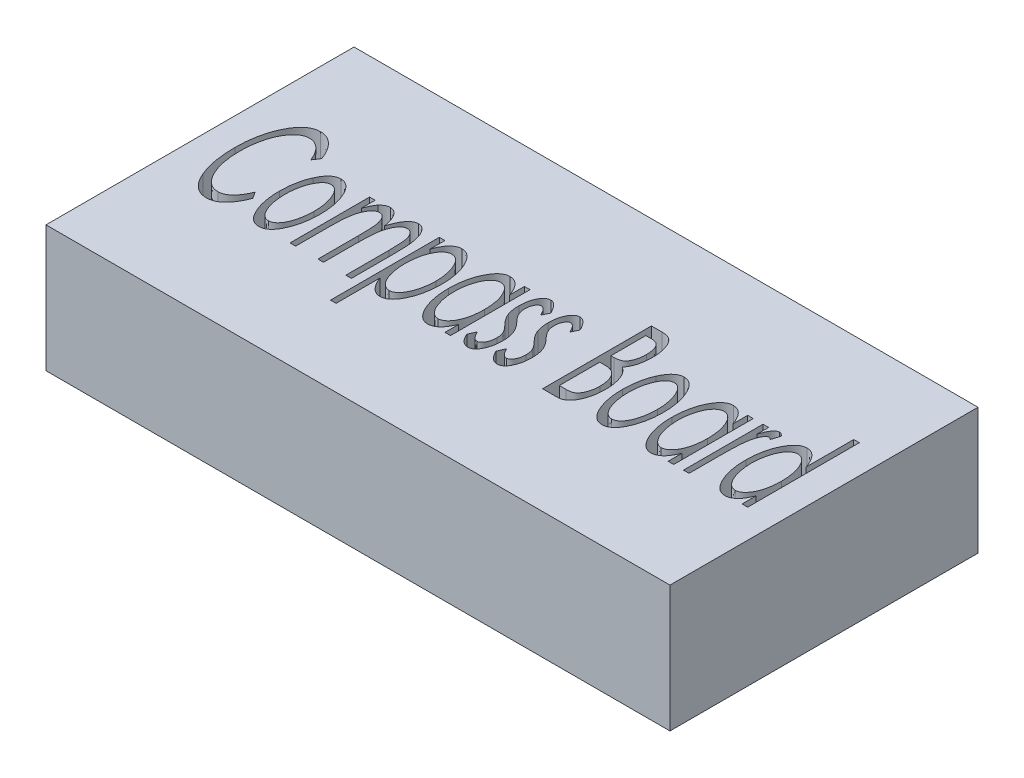
from build123d import *

# Parameters (mm, degrees)
SKETCH1_W           = 20.066
SKETCH1_H           = 9.906
BOSS_EXTRUDE1_DEPTH = 4.064
CUT_EXTRUDE1_DEPTH  = 2.032


with BuildPart() as part:
    # Sketch1 → Boss-Extrude1 (new body)
    with BuildSketch(Plane(origin=(0, 0, 0), x_dir=(1, 0, 0), z_dir=(0, 1, 0))):
        Rectangle(SKETCH1_W, SKETCH1_H)
    extrude(amount=BOSS_EXTRUDE1_DEPTH)

    # Sketch2 → Cut-Extrude1 (cut)
    # profile 1 of 12: a face of its own
    with BuildSketch(Plane(origin=(0, 4.064, 0), x_dir=(1, 0, 0), z_dir=(0, 1, 0))):
        with BuildLine():
            Line((-7.444815121, 1.324255435), (-7.582234993, 1.113918897))
            add(Edge.make_bspline(
                [(-7.582234993, 1.113918897), (-7.601593698, 1.159131827), (-7.638621926, 1.245612543), (-7.70339106, 1.364296518), (-7.775353254, 1.464971916), (-7.852491995, 1.548634953), (-7.934614473, 1.614995075), (-8.021712844, 1.66228317), (-8.113143138, 1.692277373), (-8.176097164, 1.695591787), (-8.207635634, 1.69725223)],
                knots=[0, 0, 0, 0, 1.299185471, 2.485007972, 3.564697683, 4.560911303, 5.483881321, 6.340461428, 7.168610648, 8, 8, 8, 8], degree=3))
            add(Edge.make_bspline(
                [(-8.207635634, 1.69725223), (-8.224982808, 1.696835392), (-8.259729195, 1.696000466), (-8.31092041, 1.685390949), (-8.361342017, 1.670065851), (-8.410689961, 1.648009605), (-8.458923503, 1.619812954), (-8.506577822, 1.585819423), (-8.552418696, 1.545005834), (-8.61342526, 1.481997626), (-8.684284571, 1.39034243), (-8.757665972, 1.264018838), (-8.82248454, 1.121613861), (-8.875414738, 0.962819008), (-8.917859239, 0.790698495), (-8.94849288, 0.607434675), (-8.966890989, 0.413641561), (-8.969247118, 0.281027336), (-8.970456146, 0.212977391)],
                knots=[0, 0, 0, 0, 0.45774643, 0.916866041, 1.375985651, 1.848859789, 2.34149154, 2.850576784, 3.393287444, 3.961145049, 5.167050785, 6.443546623, 7.814561503, 9.295151989, 10.860649304, 12.495527756, 14.201707638, 16, 16, 16, 16], degree=3))
            add(Edge.make_bspline(
                [(-8.970456146, 0.212977391), (-8.96983556, 0.161307023), (-8.968621124, 0.060192466), (-8.957580225, -0.088114462), (-8.941303354, -0.229783803), (-8.917297879, -0.365081808), (-8.886764262, -0.493957053), (-8.848851821, -0.61648957), (-8.803948403, -0.732145379), (-8.753409745, -0.84046125), (-8.697039706, -0.938669549), (-8.637341474, -1.025513048), (-8.57293213, -1.098578227), (-8.505539317, -1.158990736), (-8.433924736, -1.206454536), (-8.358119128, -1.239207257), (-8.278980141, -1.261222385), (-8.224610514, -1.263257292), (-8.197118807, -1.264286231)],
                knots=[0, 0, 0, 0, 1.361066875, 2.663493237, 3.915974716, 5.116529894, 6.281377342, 7.403118823, 8.492786024, 9.54768219, 10.548887674, 11.472965329, 12.319202403, 13.108680678, 13.851549293, 14.571113617, 15.277491369, 16, 16, 16, 16], degree=3))
            add(Edge.make_bspline(
                [(-8.197118807, -1.264286231), (-8.166989474, -1.26255296), (-8.10664266, -1.259081346), (-8.018684102, -1.229879603), (-7.93484018, -1.183516882), (-7.855656335, -1.117981019), (-7.780518782, -1.034755984), (-7.709152661, -0.933629873), (-7.64182815, -0.814306589), (-7.602761543, -0.726885877), (-7.582234993, -0.680952898)],
                knots=[0, 0, 0, 0, 0.803819289, 1.609990315, 2.451669169, 3.353266404, 4.343836988, 5.441246616, 6.655568437, 8, 8, 8, 8], degree=3))
            Line((-7.582234993, -0.680952898), (-7.444815121, -0.889186071))
            add(Edge.make_bspline(
                [(-7.444815121, -0.889186071), (-7.455788537, -0.917566058), (-7.477366854, -0.973372961), (-7.513170949, -1.053487533), (-7.550023825, -1.129261446), (-7.590598817, -1.199103503), (-7.631184271, -1.265484776), (-7.675846578, -1.325529766), (-7.721326211, -1.381336621), (-7.768894074, -1.43197458), (-7.818488562, -1.476608874), (-7.869388181, -1.515886474), (-7.921982524, -1.54852744), (-7.975566634, -1.576583884), (-8.031151741, -1.597623918), (-8.08833532, -1.612164686), (-8.146774561, -1.621872662), (-8.186329406, -1.622795978), (-8.20623339, -1.62326059)],
                knots=[0, 0, 0, 0, 1.296200491, 2.548871353, 3.737868192, 4.884022115, 5.989127934, 7.050667326, 8.069356663, 9.055503585, 10.007320038, 10.90950695, 11.790846336, 12.641442791, 13.482897822, 14.316123122, 15.152673735, 16, 16, 16, 16], degree=3))
            add(Edge.make_bspline(
                [(-8.20623339, -1.62326059), (-8.243590054, -1.621401644), (-8.317340825, -1.617731651), (-8.424481632, -1.587452048), (-8.525327453, -1.539186809), (-8.619851555, -1.471196849), (-8.706993718, -1.383301812), (-8.788375298, -1.277159442), (-8.863783717, -1.151892925), (-8.906176499, -1.059560325), (-8.928388839, -1.011181263)],
                knots=[0, 0, 0, 0, 0.889987636, 1.757043257, 2.634913996, 3.546251599, 4.520108944, 5.577402331, 6.730643314, 8, 8, 8, 8], degree=3))
            add(Edge.make_bspline(
                [(-8.928388839, -1.011181263), (-8.946290278, -0.967232485), (-8.982628321, -0.878021074), (-9.026518386, -0.738048644), (-9.065823192, -0.592068504), (-9.095804315, -0.438954838), (-9.121003142, -0.279546919), (-9.136956884, -0.113295232), (-9.148110086, 0.0595131), (-9.149324519, 0.176967391), (-9.149943326, 0.236815532)],
                knots=[0, 0, 0, 0, 0.892200441, 1.811073353, 2.756806339, 3.734396212, 4.744014794, 5.791127521, 6.874482058, 8, 8, 8, 8], degree=3))
            add(Edge.make_bspline(
                [(-9.149943326, 0.236815532), (-9.149168116, 0.299704521), (-9.147647775, 0.423042414), (-9.134763737, 0.604166815), (-9.113952176, 0.777599825), (-9.0847205, 0.943403609), (-9.04650644, 1.101516743), (-9.00171862, 1.252531804), (-8.946438511, 1.395446674), (-8.884193633, 1.52960254), (-8.815870658, 1.652129532), (-8.74244038, 1.759651009), (-8.66402347, 1.850376546), (-8.582079605, 1.925758598), (-8.494995274, 1.984437203), (-8.403211621, 2.02556531), (-8.30719159, 2.051371791), (-8.241447981, 2.054600484), (-8.208336755, 2.056226589)],
                knots=[0, 0, 0, 0, 1.350883623, 2.649353136, 3.89856053, 5.102044923, 6.263763384, 7.391449509, 8.483282176, 9.552439238, 10.566269587, 11.493781365, 12.344403006, 13.137041638, 13.879228367, 14.589340494, 15.289532994, 16, 16, 16, 16], degree=3))
            add(Edge.make_bspline(
                [(-8.208336755, 2.056226589), (-8.188202849, 2.055746087), (-8.14819064, 2.054791184), (-8.088945444, 2.045308379), (-8.031406542, 2.029918985), (-7.975497419, 2.008328762), (-7.920399676, 1.982206053), (-7.86790884, 1.947544989), (-7.815927016, 1.908710706), (-7.766114073, 1.863270791), (-7.717850671, 1.813118432), (-7.672181461, 1.757355464), (-7.629120279, 1.696726595), (-7.586197281, 1.632565706), (-7.548570124, 1.561836833), (-7.510803556, 1.487410262), (-7.475936161, 1.407820504), (-7.455298426, 1.352404819), (-7.444815121, 1.324255435)],
                knots=[0, 0, 0, 0, 0.856532349, 1.702190794, 2.54685376, 3.387581895, 4.250790716, 5.136691882, 6.059960502, 7.01095472, 8.003107282, 9.020916617, 10.075690141, 11.16844244, 12.303884376, 13.482947173, 14.721418249, 16, 16, 16, 16], degree=3))
        make_face()
    # profile 2 of 12: a face of its own
    with BuildSketch(Plane(origin=(0, 4.064, 0), x_dir=(1, 0, 0), z_dir=(0, 1, 0))):
        with BuildLine():
            add(Edge.make_bspline(
                [(-6.569113999, 1.069047102), (-6.545351241, 1.067982828), (-6.498087162, 1.065865989), (-6.429654448, 1.044079225), (-6.364817527, 1.010220997), (-6.30229543, 0.964161243), (-6.244380932, 0.903523064), (-6.18953805, 0.830345791), (-6.13752759, 0.74431343), (-6.107434951, 0.680923613), (-6.091650057, 0.647672903)],
                knots=[0, 0, 0, 0, 0.843577701, 1.677874383, 2.529941952, 3.44009667, 4.428447994, 5.503311921, 6.690378774, 8, 8, 8, 8], degree=3))
            add(Edge.make_bspline(
                [(-6.091650057, 0.647672903), (-6.077639866, 0.615132272), (-6.049274453, 0.549249628), (-6.014803961, 0.446183016), (-5.985333594, 0.338947576), (-5.960309351, 0.227458471), (-5.943119306, 0.111116231), (-5.928225738, -0.009183479), (-5.921012607, -0.133989047), (-5.91979333, -0.218673415), (-5.919174095, -0.261682065)],
                knots=[0, 0, 0, 0, 0.911590579, 1.845630971, 2.79426017, 3.773633235, 4.784390523, 5.820063118, 6.892875455, 8, 8, 8, 8], degree=3))
            add(Edge.make_bspline(
                [(-5.919174095, -0.261682065), (-5.919721561, -0.304928565), (-5.920799803, -0.3901031), (-5.929056854, -0.515822992), (-5.944323265, -0.637356498), (-5.96309273, -0.7550818), (-5.989849583, -0.868316684), (-6.019862223, -0.977786417), (-6.057649485, -1.082674985), (-6.099607152, -1.182339896), (-6.145467519, -1.274339641), (-6.196229658, -1.354684477), (-6.249171747, -1.423661862), (-6.306517828, -1.479859551), (-6.367036, -1.524080865), (-6.431215276, -1.555713028), (-6.499095186, -1.574692925), (-6.545625412, -1.577148975), (-6.569113999, -1.578388795)],
                knots=[0, 0, 0, 0, 1.301298947, 2.562924903, 3.788461415, 4.986201962, 6.14793309, 7.287790237, 8.39993342, 9.49971249, 10.540722194, 11.488924044, 12.355509222, 13.151197152, 13.89676473, 14.601269901, 15.293917145, 16, 16, 16, 16], degree=3))
            add(Edge.make_bspline(
                [(-6.569113999, -1.578388795), (-6.592596597, -1.577124313), (-6.639340623, -1.574607257), (-6.707518362, -1.55585814), (-6.771909912, -1.524089605), (-6.832464323, -1.479668932), (-6.890444296, -1.423712249), (-6.944151396, -1.35489984), (-6.994841886, -1.274316743), (-7.040658287, -1.182322818), (-7.082957497, -1.082846008), (-7.119264138, -0.977486144), (-7.15107756, -0.868587263), (-7.175913006, -0.754861579), (-7.196594741, -0.637518021), (-7.210218165, -0.515746288), (-7.218924116, -0.390116021), (-7.219940227, -0.304932916), (-7.220456146, -0.261682065)],
                knots=[0, 0, 0, 0, 0.705440217, 1.4042363, 2.108100269, 2.852989273, 3.652997896, 4.523145192, 5.47048404, 6.510546275, 7.609324387, 8.718120464, 9.858867499, 11.017987859, 12.215813406, 13.439407729, 14.699885423, 16, 16, 16, 16], degree=3))
            add(Edge.make_bspline(
                [(-7.220456146, -0.261682065), (-7.219841633, -0.218905774), (-7.218628398, -0.134452526), (-7.211307086, -0.009900852), (-7.196883106, 0.110280665), (-7.178177513, 0.225892047), (-7.154341713, 0.337358113), (-7.125032496, 0.444384771), (-7.090203882, 0.547326366), (-7.061969037, 0.613021246), (-7.047980185, 0.645569538)],
                knots=[0, 0, 0, 0, 1.103600926, 2.178839769, 3.216854868, 4.224898256, 5.199312966, 6.155900535, 7.086347569, 8, 8, 8, 8], degree=3))
            add(Edge.make_bspline(
                [(-7.047980185, 0.645569538), (-7.032225108, 0.6790699), (-7.002270166, 0.742763744), (-6.949919159, 0.829211975), (-6.894810756, 0.902656275), (-6.836427066, 0.963094196), (-6.774848695, 1.010719212), (-6.709184897, 1.043998141), (-6.640369047, 1.065818652), (-6.592878018, 1.067970393), (-6.569113999, 1.069047102)],
                knots=[0, 0, 0, 0, 1.3116991, 2.493918051, 3.576000503, 4.560315464, 5.46508553, 6.321043193, 7.159867415, 8, 8, 8, 8], degree=3))
        make_face()
        with BuildLine():
            add(Edge.make_bspline(
                [(-6.569815121, 0.754944538), (-6.585817273, 0.753974903), (-6.617739181, 0.752040627), (-6.664310233, 0.736994266), (-6.708971826, 0.713634319), (-6.751605495, 0.680180672), (-6.792892783, 0.638221026), (-6.831280748, 0.586021201), (-6.868549655, 0.525285934), (-6.903664863, 0.456099387), (-6.93535382, 0.379967858), (-6.964302901, 0.299647779), (-6.988119209, 0.215294477), (-7.006808827, 0.12689609), (-7.022244152, 0.034754978), (-7.0335371, -0.061392225), (-7.039775167, -0.161336937), (-7.040565818, -0.229188329), (-7.040968967, -0.26378543)],
                knots=[0, 0, 0, 0, 0.633328474, 1.263395849, 1.922297409, 2.622747561, 3.402359392, 4.249154536, 5.185072166, 6.225072861, 7.321168891, 8.452296706, 9.607823688, 10.792618436, 12.032427099, 13.310317054, 14.628543482, 16, 16, 16, 16], degree=3))
            add(Edge.make_bspline(
                [(-7.040968967, -0.26378543), (-7.040131881, -0.308450497), (-7.03848099, -0.396538391), (-7.026293236, -0.526277064), (-7.006827352, -0.651371795), (-6.979859376, -0.770202017), (-6.946326064, -0.880443355), (-6.905678444, -0.978316473), (-6.861281324, -1.06406503), (-6.810167128, -1.135027583), (-6.755111893, -1.192236423), (-6.695992946, -1.232946702), (-6.634210758, -1.260154477), (-6.5911097, -1.262919928), (-6.569815121, -1.264286231)],
                knots=[0, 0, 0, 0, 1.343625255, 2.649881141, 3.916827948, 5.150040387, 6.313170605, 7.378672881, 8.334918638, 9.211145051, 10.001680462, 10.70963726, 11.362481287, 12, 12, 12, 12], degree=3))
            add(Edge.make_bspline(
                [(-6.569815121, -1.264286231), (-6.548518565, -1.262921983), (-6.505413505, -1.260160693), (-6.443662752, -1.232920237), (-6.384544382, -1.192443234), (-6.330158475, -1.134781337), (-6.279166999, -1.063901546), (-6.233643024, -0.978681587), (-6.194231102, -0.880238765), (-6.160595414, -0.770137785), (-6.132585303, -0.651470819), (-6.11339989, -0.526263963), (-6.101132799, -0.396541818), (-6.099492825, -0.30845165), (-6.098661275, -0.26378543)],
                knots=[0, 0, 0, 0, 0.63766136, 1.290651464, 1.99876667, 2.784553339, 3.660975812, 4.620765142, 5.683833951, 6.847224424, 8.082295646, 9.349525938, 10.656074103, 12, 12, 12, 12], degree=3))
            add(Edge.make_bspline(
                [(-6.098661275, -0.26378543), (-6.099066069, -0.229188667), (-6.099859946, -0.161337938), (-6.10607477, -0.061388448), (-6.117451884, 0.034741452), (-6.132596236, 0.126993626), (-6.152354473, 0.215223683), (-6.176239648, 0.29947915), (-6.203912546, 0.380291672), (-6.236862722, 0.455927161), (-6.271790782, 0.525255107), (-6.308916519, 0.586314629), (-6.348231157, 0.637737101), (-6.388700206, 0.680425964), (-6.431396597, 0.713599432), (-6.476012118, 0.737003885), (-6.522370593, 0.751962615), (-6.554050411, 0.753953715), (-6.569815121, 0.754944538)],
                knots=[0, 0, 0, 0, 1.372102031, 2.690948916, 3.969440344, 5.209832555, 6.397176509, 7.553247371, 8.681828641, 9.782077646, 10.822567844, 11.758925988, 12.611729478, 13.385237583, 14.08601742, 14.74522911, 15.375593043, 16, 16, 16, 16], degree=3))
        make_face(mode=Mode.SUBTRACT)
    # profile 3 of 12: a face of its own
    with BuildSketch(Plane(origin=(0, 4.064, 0), x_dir=(1, 0, 0), z_dir=(0, 1, 0))):
        with BuildLine():
            Line((-5.605071531, 1.024175307), (-5.425584352, 1.024175307))
            Line((-5.425584352, 1.024175307), (-5.425584352, 0.579664089))
            add(Edge.make_bspline(
                [(-5.425584352, 0.579664089), (-5.411446985, 0.618237437), (-5.384888752, 0.690700713), (-5.33892385, 0.788714711), (-5.294430821, 0.871567383), (-5.259924643, 0.917933314), (-5.243993807, 0.93933957)],
                knots=[0, 0, 0, 0, 1.217816216, 2.287770118, 3.209496512, 4, 4, 4, 4], degree=3))
            add(Edge.make_bspline(
                [(-5.243993807, 0.93933957), (-5.223147089, 0.95908836), (-5.183370459, 0.996770085), (-5.115825199, 1.038143649), (-5.045963888, 1.063800943), (-4.998335261, 1.067310274), (-4.974763038, 1.069047102)],
                knots=[0, 0, 0, 0, 1.120991578, 2.138910614, 3.078914958, 4, 4, 4, 4], degree=3))
            add(Edge.make_bspline(
                [(-4.974763038, 1.069047102), (-4.959028271, 1.067957889), (-4.927251413, 1.06575819), (-4.880285819, 1.052221835), (-4.835431675, 1.027988742), (-4.79223769, 0.995597269), (-4.751389555, 0.955905734), (-4.713846517, 0.909883177), (-4.680794538, 0.857571371), (-4.651874515, 0.797867671), (-4.624587689, 0.729149953), (-4.600690633, 0.648330035), (-4.578267645, 0.554434165), (-4.565694817, 0.487181436), (-4.558997813, 0.451358801)],
                knots=[0, 0, 0, 0, 0.70497467, 1.423718626, 2.167988911, 2.97590154, 3.834418343, 4.712110969, 5.629520406, 6.598314936, 7.678802742, 8.936786955, 10.368358232, 12, 12, 12, 12], degree=3))
            add(Edge.make_bspline(
                [(-4.558997813, 0.451358801), (-4.544771301, 0.499042584), (-4.517798111, 0.589450109), (-4.468226059, 0.714335723), (-4.413101042, 0.821004201), (-4.353217779, 0.909699154), (-4.288501489, 0.979575918), (-4.220950395, 1.030882717), (-4.149394311, 1.063110056), (-4.100056528, 1.067097031), (-4.075924896, 1.069047102)],
                knots=[0, 0, 0, 0, 1.430898735, 2.712956173, 3.858598611, 4.878593333, 5.782223817, 6.584917614, 7.307868261, 8, 8, 8, 8], degree=3))
            add(Edge.make_bspline(
                [(-4.075924896, 1.069047102), (-4.053744199, 1.067357568), (-4.00917873, 1.063962954), (-3.944772167, 1.038048092), (-3.886540058, 0.993865997), (-3.83271262, 0.934898071), (-3.783836363, 0.861647102), (-3.742113293, 0.774620064), (-3.707269033, 0.674581468), (-3.683938639, 0.582161074), (-3.6684506, 0.499487248), (-3.657923769, 0.428883037), (-3.649813622, 0.350722636), (-3.642838313, 0.265396092), (-3.637340205, 0.172589752), (-3.63298135, 0.07232343), (-3.631143231, -0.035446362), (-3.630859085, -0.109772032), (-3.630712557, -0.148100334)],
                knots=[0, 0, 0, 0, 0.756463087, 1.519885966, 2.330984414, 3.234758128, 4.235496569, 5.327959897, 6.52219358, 7.848426635, 8.57957358, 9.394668963, 10.285911105, 11.263066096, 12.318715349, 13.461245202, 14.690813573, 16, 16, 16, 16], degree=3))
            Line((-3.630712557, -0.148100334), (-3.630712557, -1.533517001))
            Line((-3.630712557, -1.533517001), (-3.810199736, -1.533517001))
            Line((-3.810199736, -1.533517001), (-3.810199736, -0.14669809))
            add(Edge.make_bspline(
                [(-3.810199736, -0.14669809), (-3.810370352, -0.113978331), (-3.810698193, -0.051106797), (-3.812171542, 0.039105601), (-3.813962505, 0.121396191), (-3.817584516, 0.195482125), (-3.821787141, 0.261626929), (-3.826343829, 0.319899771), (-3.83266406, 0.370158762), (-3.84168698, 0.425621453), (-3.856472853, 0.486345646), (-3.878191882, 0.552528749), (-3.906619046, 0.610956716), (-3.939791087, 0.66099588), (-3.976754628, 0.702883001), (-4.018606914, 0.732866589), (-4.064551639, 0.75210005), (-4.096775048, 0.753988655), (-4.113084352, 0.754944538)],
                knots=[0, 0, 0, 0, 1.51836297, 2.917558436, 4.186860745, 5.337727298, 6.359248196, 7.262593179, 8.049522409, 8.709208536, 9.869236563, 10.946135496, 11.935605254, 12.874073121, 13.726161472, 14.511594637, 15.246670199, 16, 16, 16, 16], degree=3))
            add(Edge.make_bspline(
                [(-4.113084352, 0.754944538), (-4.133263374, 0.753406181), (-4.1744742, 0.750264454), (-4.232781058, 0.720575215), (-4.287907449, 0.675576366), (-4.338527902, 0.613440505), (-4.385217444, 0.537831733), (-4.42507006, 0.449344976), (-4.457278403, 0.349245038), (-4.47987861, 0.257592676), (-4.493093243, 0.17478752), (-4.503223269, 0.101929594), (-4.510492727, 0.019076723), (-4.516538463, -0.073511956), (-4.522538591, -0.175851498), (-4.525595595, -0.288075769), (-4.527809903, -0.410076905), (-4.528032736, -0.494686908), (-4.528148454, -0.538625174)],
                knots=[0, 0, 0, 0, 0.660002353, 1.34789691, 2.107969646, 2.991979148, 3.96914392, 5.025409628, 6.175424129, 7.424845589, 8.126354717, 8.933170354, 9.844345944, 10.861583212, 11.98578703, 13.216546376, 14.554542928, 16, 16, 16, 16], degree=3))
            Line((-4.528148454, -0.538625174), (-4.528148454, -1.533517001))
            Line((-4.528148454, -1.533517001), (-4.707635634, -1.533517001))
            Line((-4.707635634, -1.533517001), (-4.707635634, -0.232936071))
            add(Edge.make_bspline(
                [(-4.707635634, -0.232936071), (-4.707814041, -0.196243583), (-4.70815723, -0.125660591), (-4.709529563, -0.024461296), (-4.711632851, 0.067624562), (-4.714244699, 0.15037773), (-4.718111006, 0.223820495), (-4.724309874, 0.288006107), (-4.729063436, 0.343105942), (-4.738672036, 0.403053401), (-4.751803145, 0.468611499), (-4.775274544, 0.538913081), (-4.802932117, 0.60144835), (-4.836544327, 0.654743689), (-4.873984187, 0.699115135), (-4.91631322, 0.731557256), (-4.963134635, 0.751238479), (-4.995620451, 0.75370619), (-5.011922493, 0.754944538)],
                knots=[0, 0, 0, 0, 1.574861193, 3.029459675, 4.343833698, 5.52814318, 6.583091089, 7.499410718, 8.295893451, 8.955563666, 10.104512628, 11.160794949, 12.130411979, 13.03206512, 13.856786337, 14.609093303, 15.302014803, 16, 16, 16, 16], degree=3))
            add(Edge.make_bspline(
                [(-5.011922493, 0.754944538), (-5.031142404, 0.753298666), (-5.070838277, 0.749899361), (-5.127566296, 0.721170682), (-5.181422594, 0.677077093), (-5.231959541, 0.616790349), (-5.278546169, 0.542808982), (-5.317807771, 0.455594669), (-5.352601806, 0.357531518), (-5.374637025, 0.266852738), (-5.389194798, 0.186302992), (-5.399001066, 0.117074579), (-5.40717671, 0.040129705), (-5.414378443, -0.044474327), (-5.418702036, -0.136866315), (-5.423381552, -0.236633425), (-5.425142907, -0.344408427), (-5.425433556, -0.418733417), (-5.425584352, -0.457295045)],
                knots=[0, 0, 0, 0, 0.667901347, 1.379451074, 2.174339452, 3.088250632, 4.111091931, 5.216854925, 6.419016473, 7.738532864, 8.468087668, 9.275556869, 10.178113764, 11.168435705, 12.23848396, 13.405914129, 14.654124622, 16, 16, 16, 16], degree=3))
            Line((-5.425584352, -0.457295045), (-5.425584352, -1.533517001))
            Line((-5.425584352, -1.533517001), (-5.605071531, -1.533517001))
            Line((-5.605071531, -1.533517001), (-5.605071531, 1.024175307))
        make_face()
    # profile 4 of 12: a face of its own
    with BuildSketch(Plane(origin=(0, 4.064, 0), x_dir=(1, 0, 0), z_dir=(0, 1, 0))):
        with BuildLine():
            Line((-3.361481788, 1.024175307), (-3.181994608, 1.024175307))
            Line((-3.181994608, 1.024175307), (-3.181994608, 0.550918096))
            add(Edge.make_bspline(
                [(-3.181994608, 0.550918096), (-3.166016998, 0.593356161), (-3.135885693, 0.673387796), (-3.080396902, 0.781095301), (-3.024013128, 0.872279907), (-2.961556175, 0.944540067), (-2.8952474, 0.999723736), (-2.825750187, 1.040357368), (-2.751431418, 1.0645403), (-2.700489832, 1.067547373), (-2.67508355, 1.069047102)],
                knots=[0, 0, 0, 0, 1.406286568, 2.652039174, 3.754729358, 4.726455888, 5.602288883, 6.421049685, 7.21252437, 8, 8, 8, 8], degree=3))
            add(Edge.make_bspline(
                [(-2.67508355, 1.069047102), (-2.652771804, 1.067726158), (-2.608169148, 1.065085502), (-2.542449593, 1.046835901), (-2.479292237, 1.016210025), (-2.419622536, 0.972467044), (-2.362138731, 0.917569618), (-2.307666257, 0.850468219), (-2.255955177, 0.771213726), (-2.206920677, 0.681598422), (-2.161638977, 0.583557962), (-2.122629572, 0.479169419), (-2.089759317, 0.369954568), (-2.062108871, 0.256045542), (-2.041597769, 0.136990932), (-2.025937878, 0.013032934), (-2.016758628, -0.11570807), (-2.015809554, -0.203240767), (-2.015327941, -0.247659629)],
                knots=[0, 0, 0, 0, 0.670262019, 1.339898088, 2.03416756, 2.76903416, 3.554020332, 4.4173937, 5.360277513, 6.394539248, 7.485083677, 8.603126358, 9.740787813, 10.911175182, 12.123695205, 13.369529111, 14.665155706, 16, 16, 16, 16], degree=3))
            add(Edge.make_bspline(
                [(-2.015327941, -0.247659629), (-2.015810283, -0.293012321), (-2.016758585, -0.382177465), (-2.025882672, -0.51326431), (-2.041776891, -0.639009519), (-2.061271439, -0.76006264), (-2.089060926, -0.875541846), (-2.121599479, -0.986047473), (-2.161234055, -1.090800821), (-2.205541153, -1.189473194), (-2.253576436, -1.279902055), (-2.305597501, -1.358928112), (-2.359606408, -1.426081804), (-2.415687978, -1.482121232), (-2.475916505, -1.524572589), (-2.538292835, -1.555320606), (-2.603365515, -1.574690258), (-2.647844485, -1.577152564), (-2.670175698, -1.578388795)],
                knots=[0, 0, 0, 0, 1.354215587, 2.662440161, 3.921082787, 5.138414895, 6.32168119, 7.465429902, 8.576320725, 9.663344847, 10.693783236, 11.630635642, 12.484074616, 13.26385205, 13.989970941, 14.673522071, 15.334025491, 16, 16, 16, 16], degree=3))
            add(Edge.make_bspline(
                [(-2.670175698, -1.578388795), (-2.695412896, -1.577067872), (-2.745951559, -1.574422662), (-2.818746205, -1.54747565), (-2.889052245, -1.507784755), (-2.954819124, -1.450244101), (-3.017654176, -1.377770968), (-3.075975405, -1.289052852), (-3.132254071, -1.185608531), (-3.164861404, -1.109871025), (-3.181994608, -1.070075494)],
                knots=[0, 0, 0, 0, 0.789213229, 1.580436154, 2.408592609, 3.31424838, 4.307478014, 5.412469104, 6.640407215, 8, 8, 8, 8], degree=3))
            Line((-3.181994608, -1.070075494), (-3.181994608, -2.475824693))
            Line((-3.181994608, -2.475824693), (-3.361481788, -2.475824693))
            Line((-3.361481788, -2.475824693), (-3.361481788, 1.024175307))
        make_face()
        with BuildLine():
            add(Edge.make_bspline(
                [(-2.689105986, 0.754944538), (-2.70628141, 0.754282585), (-2.740527896, 0.7529627), (-2.790119855, 0.737653297), (-2.838114735, 0.715527831), (-2.882323458, 0.681617541), (-2.926194881, 0.64129363), (-2.966958705, 0.5904526), (-3.005095121, 0.530698884), (-3.041191536, 0.462849892), (-3.074596188, 0.388732682), (-3.103219318, 0.30892773), (-3.127856993, 0.224933626), (-3.147191445, 0.136306401), (-3.16270923, 0.043413821), (-3.173650375, -0.053946549), (-3.181044089, -0.155698473), (-3.181673742, -0.224976383), (-3.181994608, -0.260279821)],
                knots=[0, 0, 0, 0, 0.670502511, 1.336930885, 2.01661879, 2.730697091, 3.50787945, 4.347116028, 5.273897788, 6.281389318, 7.354919519, 8.455316699, 9.599578916, 10.781131471, 12.006139932, 13.286961451, 14.617458464, 16, 16, 16, 16], degree=3))
            add(Edge.make_bspline(
                [(-3.181994608, -0.260279821), (-3.181186071, -0.306581683), (-3.179611118, -0.396773262), (-3.167386642, -0.52861765), (-3.148113265, -0.653298543), (-3.12110643, -0.770134954), (-3.086649943, -0.877704334), (-3.043624623, -0.97366208), (-2.995735641, -1.059321392), (-2.939729356, -1.131125173), (-2.880270947, -1.189781027), (-2.81783772, -1.232434805), (-2.753066213, -1.25905932), (-2.708728245, -1.262567313), (-2.687002621, -1.264286231)],
                knots=[0, 0, 0, 0, 1.372352145, 2.673210177, 3.92153853, 5.109626445, 6.224758735, 7.263711478, 8.222692806, 9.126218395, 9.954239084, 10.68823601, 11.357235037, 12, 12, 12, 12], degree=3))
            add(Edge.make_bspline(
                [(-2.687002621, -1.264286231), (-2.665471487, -1.262656714), (-2.621637204, -1.259339253), (-2.558448695, -1.231406656), (-2.497063856, -1.18943384), (-2.44037305, -1.129159374), (-2.386546269, -1.055561513), (-2.33823587, -0.967865013), (-2.296597751, -0.866775684), (-2.260802359, -0.754379977), (-2.232089916, -0.633841575), (-2.209969682, -0.50890164), (-2.19724631, -0.380905488), (-2.195630202, -0.294661988), (-2.194815121, -0.251165238)],
                knots=[0, 0, 0, 0, 0.635011951, 1.2927927, 2.014317907, 2.826440425, 3.727250082, 4.708985206, 5.781851138, 6.958931803, 8.197281202, 9.44726758, 10.712534114, 12, 12, 12, 12], degree=3))
            add(Edge.make_bspline(
                [(-2.194815121, -0.251165238), (-2.195598791, -0.207429988), (-2.197148505, -0.120943209), (-2.210251687, 0.007180905), (-2.230947406, 0.131878099), (-2.260343601, 0.251522841), (-2.295611984, 0.362943286), (-2.337911406, 0.462672124), (-2.384839574, 0.549823543), (-2.438950733, 0.622095332), (-2.496145658, 0.680688102), (-2.557137027, 0.723403173), (-2.622099221, 0.74986797), (-2.666911174, 0.753263014), (-2.689105986, 0.754944538)],
                knots=[0, 0, 0, 0, 1.297248402, 2.565318262, 3.816903125, 5.044520488, 6.217609186, 7.280078505, 8.25456233, 9.146222972, 9.950280187, 10.673404007, 11.34295325, 12, 12, 12, 12], degree=3))
        make_face(mode=Mode.SUBTRACT)
    # profile 5 of 12: a face of its own
    with BuildSketch(Plane(origin=(0, 4.064, 0), x_dir=(1, 0, 0), z_dir=(0, 1, 0))):
        with BuildLine():
            Line((-0.444815121, 1.024175307), (-0.444815121, -1.533517001))
            Line((-0.444815121, -1.533517001), (-0.6243023, -1.533517001))
            Line((-0.6243023, -1.533517001), (-0.6243023, -1.091109148))
            add(Edge.make_bspline(
                [(-0.6243023, -1.091109148), (-0.641411647, -1.130678391), (-0.673806043, -1.205597778), (-0.729817141, -1.307390676), (-0.78927611, -1.392322413), (-0.85192261, -1.461205937), (-0.91872912, -1.513466419), (-0.98849507, -1.550478729), (-1.061374277, -1.574816398), (-1.111628872, -1.577195908), (-1.136822332, -1.578388795)],
                knots=[0, 0, 0, 0, 1.376809071, 2.606814916, 3.704840143, 4.68230614, 5.570980294, 6.39935724, 7.197571305, 8, 8, 8, 8], degree=3))
            add(Edge.make_bspline(
                [(-1.136822332, -1.578388795), (-1.159155918, -1.5771557), (-1.203639615, -1.574699638), (-1.268676661, -1.555282905), (-1.331023823, -1.52480741), (-1.390676284, -1.481642175), (-1.447446287, -1.426388143), (-1.501348566, -1.358873264), (-1.553450131, -1.279923591), (-1.6013955, -1.189447354), (-1.645958334, -1.090959985), (-1.684468854, -0.985879329), (-1.717378812, -0.875578737), (-1.744712448, -0.759968412), (-1.765718359, -0.639151685), (-1.780078998, -0.513191871), (-1.78962751, -0.382189266), (-1.790516695, -0.293016299), (-1.790968967, -0.247659629)],
                knots=[0, 0, 0, 0, 0.666089695, 1.326707355, 2.010376711, 2.730929822, 3.515855088, 4.369441671, 5.306456114, 6.337072726, 7.424284859, 8.532931352, 9.676877885, 10.860348837, 12.079071447, 13.337099347, 14.645550189, 16, 16, 16, 16], degree=3))
            add(Edge.make_bspline(
                [(-1.790968967, -0.247659629), (-1.790487355, -0.203240767), (-1.78953828, -0.11570807), (-1.78035903, 0.013032935), (-1.76469914, 0.136990932), (-1.744188038, 0.256045544), (-1.716537588, 0.369954563), (-1.683667345, 0.479169438), (-1.644657899, 0.583557894), (-1.599376347, 0.681598664), (-1.550341339, 0.771212904), (-1.498631928, 0.850470892), (-1.444154009, 0.917560891), (-1.386688032, 0.972495641), (-1.327128682, 1.015988387), (-1.264395719, 1.046999456), (-1.198816165, 1.065059055), (-1.154221986, 1.067717339), (-1.13191448, 1.069047102)],
                knots=[0, 0, 0, 0, 1.335371572, 2.631509953, 3.877835977, 5.090834958, 6.261684642, 7.399795486, 8.518279806, 9.609255011, 10.64392529, 11.587181553, 12.450895962, 13.236192212, 13.971349092, 14.659572638, 15.329473221, 16, 16, 16, 16], degree=3))
            add(Edge.make_bspline(
                [(-1.13191448, 1.069047102), (-1.106266456, 1.067577499), (-1.055074263, 1.064644242), (-0.980413762, 1.040178846), (-0.910454933, 0.999956113), (-0.844014886, 0.944533968), (-0.781685434, 0.87207405), (-0.724264791, 0.781503079), (-0.669846476, 0.673274125), (-0.640087747, 0.593326254), (-0.6243023, 0.550918096)],
                knots=[0, 0, 0, 0, 0.79355211, 1.583890976, 2.407773762, 3.282349877, 4.252681915, 5.357713838, 6.598405581, 8, 8, 8, 8], degree=3))
            Line((-0.6243023, 0.550918096), (-0.6243023, 1.024175307))
            Line((-0.6243023, 1.024175307), (-0.444815121, 1.024175307))
        make_face()
        with BuildLine():
            add(Edge.make_bspline(
                [(-1.117190922, 0.754944538), (-1.139382774, 0.753260269), (-1.184188751, 0.749859681), (-1.249197641, 0.723438195), (-1.310125793, 0.680442224), (-1.368180842, 0.622603621), (-1.421191643, 0.549332826), (-1.469319542, 0.462949039), (-1.511313947, 0.362892356), (-1.54661768, 0.251528178), (-1.576279642, 0.131951543), (-1.595799136, 0.007102283), (-1.609212951, -0.120932734), (-1.610719796, -0.20742647), (-1.611481788, -0.251165238)],
                knots=[0, 0, 0, 0, 0.656881251, 1.326261846, 2.049203523, 2.857974616, 3.745277556, 4.722888579, 5.785090279, 6.957883496, 8.185191643, 9.435327898, 10.703078354, 12, 12, 12, 12], degree=3))
            add(Edge.make_bspline(
                [(-1.611481788, -0.251165238), (-1.610686679, -0.29466516), (-1.60911017, -0.38091495), (-1.596098896, -0.508825429), (-1.575077955, -0.633899914), (-1.546364179, -0.754520893), (-1.509525617, -0.866637716), (-1.46812295, -0.967897969), (-1.41968715, -1.055500361), (-1.366001867, -1.129480696), (-1.308583952, -1.188928778), (-1.247630296, -1.231833727), (-1.184114098, -1.2591927), (-1.140104021, -1.262613999), (-1.118593166, -1.264286231)],
                knots=[0, 0, 0, 0, 1.286766066, 2.551344847, 3.799484014, 5.037160291, 6.215732796, 7.288015557, 8.269217045, 9.169537055, 9.986063156, 10.701505158, 11.365333219, 12, 12, 12, 12], degree=3))
            add(Edge.make_bspline(
                [(-1.118593166, -1.264286231), (-1.096628116, -1.262593834), (-1.052043303, -1.259158595), (-0.987071651, -1.232413963), (-0.924697596, -1.18996058), (-0.865783061, -1.131106397), (-0.810823456, -1.05886701), (-0.761480424, -0.974251108), (-0.720773129, -0.877291312), (-0.685943112, -0.770103146), (-0.657981282, -0.65339127), (-0.638970148, -0.52860641), (-0.626669586, -0.396776304), (-0.62510534, -0.306582715), (-0.6243023, -0.260279821)],
                knots=[0, 0, 0, 0, 0.649788265, 1.318944836, 2.053114612, 2.87635825, 3.775862624, 4.738542696, 5.77218038, 6.887575275, 8.077537979, 9.326160303, 10.627324677, 12, 12, 12, 12], degree=3))
            add(Edge.make_bspline(
                [(-0.6243023, -0.260279821), (-0.624623167, -0.224976383), (-0.62525282, -0.155698473), (-0.632646531, -0.053946547), (-0.643587686, 0.043413812), (-0.659105435, 0.136306432), (-0.678440013, 0.224933517), (-0.703077244, 0.308928118), (-0.731701946, 0.388731308), (-0.765101033, 0.462854756), (-0.801216381, 0.530682524), (-0.83929044, 0.590506145), (-0.880149859, 0.640987214), (-0.923341759, 0.682097552), (-0.96812587, 0.715295192), (-1.016147466, 0.737692196), (-1.065776401, 0.752952986), (-1.100017966, 0.75427934), (-1.117190922, 0.754944538)],
                knots=[0, 0, 0, 0, 1.382476414, 2.712910757, 3.993671946, 5.218622704, 6.400119605, 7.544327924, 8.644673272, 9.718152906, 10.72559698, 11.652335086, 12.491532133, 13.262018601, 13.983476199, 14.663132088, 15.329529072, 16, 16, 16, 16], degree=3))
        make_face(mode=Mode.SUBTRACT)
    # profile 6 of 12: a face of its own
    with BuildSketch(Plane(origin=(0, 4.064, 0), x_dir=(1, 0, 0), z_dir=(0, 1, 0))):
        with BuildLine():
            Line((0.542364366, 0.705164891), (0.435793854, 0.485713769))
            add(Edge.make_bspline(
                [(0.435793854, 0.485713769), (0.42546286, 0.506839443), (0.405937289, 0.546766952), (0.37538238, 0.602065084), (0.343815764, 0.648276573), (0.313079623, 0.686455392), (0.282891392, 0.717057012), (0.251911357, 0.73818879), (0.220988926, 0.752331859), (0.199879706, 0.754094521), (0.189700104, 0.754944538)],
                knots=[0, 0, 0, 0, 1.482177522, 2.801314489, 3.977963893, 5.004001084, 5.889395314, 6.67382825, 7.360473737, 8, 8, 8, 8], degree=3))
            add(Edge.make_bspline(
                [(0.189700104, 0.754944538), (0.177017624, 0.753801108), (0.15122541, 0.751475726), (0.116086222, 0.728860538), (0.084100067, 0.695590327), (0.056719488, 0.650164941), (0.033370735, 0.597382974), (0.016599222, 0.538854221), (0.005738226, 0.476302174), (0.004525262, 0.432943376), (0.003902828, 0.410693737)],
                knots=[0, 0, 0, 0, 0.710238369, 1.444403671, 2.294577681, 3.309895319, 4.421947424, 5.550746484, 6.743161433, 8, 8, 8, 8], degree=3))
            add(Edge.make_bspline(
                [(0.003902828, 0.410693737), (0.004432974, 0.39056605), (0.005479535, 0.350832027), (0.014134933, 0.291814009), (0.028888906, 0.23437094), (0.042610437, 0.197213462), (0.049475745, 0.178622423)],
                knots=[0, 0, 0, 0, 1.014766386, 2.003248184, 3.0009631, 4, 4, 4, 4], degree=3))
            add(Edge.make_bspline(
                [(0.049475745, 0.178622423), (0.058597735, 0.158972629), (0.078406333, 0.116302684), (0.120853907, 0.053228769), (0.174631675, -0.01552484), (0.216886668, -0.060794431), (0.239479751, -0.084999372)],
                knots=[0, 0, 0, 0, 0.794880729, 1.726100408, 2.784181504, 4, 4, 4, 4], degree=3))
            add(Edge.make_bspline(
                [(0.239479751, -0.084999372), (0.267168969, -0.115133508), (0.320304123, -0.172960419), (0.387641321, -0.263940391), (0.442690428, -0.352717159), (0.467877294, -0.414381078), (0.479964527, -0.443973731)],
                knots=[0, 0, 0, 0, 1.128253976, 2.165100852, 3.119427793, 4, 4, 4, 4], degree=3))
            add(Edge.make_bspline(
                [(0.479964527, -0.443973731), (0.48965866, -0.47396335), (0.509411307, -0.53506983), (0.528604262, -0.631664251), (0.539731376, -0.733739299), (0.541472653, -0.803620205), (0.542364366, -0.839406424)],
                knots=[0, 0, 0, 0, 0.939800267, 1.914925577, 2.932227216, 4, 4, 4, 4], degree=3))
            add(Edge.make_bspline(
                [(0.542364366, -0.839406424), (0.541042897, -0.889020574), (0.538493922, -0.984721041), (0.518305294, -1.122760989), (0.483356662, -1.249018285), (0.44263399, -1.344881786), (0.405191297, -1.413426384), (0.375089366, -1.457331155), (0.342582351, -1.494047137), (0.308807112, -1.524534773), (0.27353352, -1.549091945), (0.235979004, -1.566027661), (0.196551743, -1.576291126), (0.169662009, -1.577683672), (0.156046257, -1.578388795)],
                knots=[0, 0, 0, 0, 1.964211337, 3.788756683, 5.508791318, 7.138408542, 7.900685264, 8.598982512, 9.241512287, 9.837930235, 10.397523955, 10.935978534, 11.461227373, 12, 12, 12, 12], degree=3))
            add(Edge.make_bspline(
                [(0.156046257, -1.578388795), (0.137658014, -1.577396848), (0.100729618, -1.575404757), (0.046725383, -1.555947061), (-0.006061276, -1.527252805), (-0.056637551, -1.486541323), (-0.104026086, -1.435712479), (-0.148160828, -1.376062808), (-0.187584948, -1.307455166), (-0.209252552, -1.257740448), (-0.220456146, -1.232034629)],
                knots=[0, 0, 0, 0, 0.813020151, 1.63275687, 2.519043534, 3.471237512, 4.49812913, 5.595180671, 6.756548291, 8, 8, 8, 8], degree=3))
            Line((-0.220456146, -1.232034629), (-0.115988999, -0.995055462))
            add(Edge.make_bspline(
                [(-0.115988999, -0.995055462), (-0.106179948, -1.016206356), (-0.087611867, -1.056244021), (-0.057573778, -1.111312195), (-0.0268351, -1.157951844), (0.004632232, -1.196343952), (0.036936837, -1.226212694), (0.069607954, -1.248036043), (0.103140796, -1.26166174), (0.126020976, -1.263429173), (0.137115969, -1.264286231)],
                knots=[0, 0, 0, 0, 1.442062427, 2.729757616, 3.876560305, 4.892813147, 5.793368078, 6.587348904, 7.314981156, 8, 8, 8, 8], degree=3))
            add(Edge.make_bspline(
                [(0.137115969, -1.264286231), (0.152642729, -1.262836388), (0.184091359, -1.259899806), (0.227175504, -1.233508802), (0.266616231, -1.194534441), (0.299075392, -1.140344775), (0.327591066, -1.077374076), (0.348525486, -1.007365977), (0.360483131, -0.931664382), (0.36206073, -0.879647901), (0.362877187, -0.852727738)],
                knots=[0, 0, 0, 0, 0.723848605, 1.46611702, 2.312433226, 3.314566267, 4.410479446, 5.556826528, 6.735580985, 8, 8, 8, 8], degree=3))
            add(Edge.make_bspline(
                [(0.362877187, -0.852727738), (0.36236882, -0.830495392), (0.361375011, -0.78703324), (0.35275887, -0.723887717), (0.339122765, -0.664277489), (0.324974317, -0.627066103), (0.318005392, -0.608737353)],
                knots=[0, 0, 0, 0, 1.068229305, 2.088288194, 3.058371884, 4, 4, 4, 4], degree=3))
            add(Edge.make_bspline(
                [(0.318005392, -0.608737353), (0.308596469, -0.590039736), (0.287694526, -0.54850294), (0.2433733, -0.48584883), (0.184196334, -0.41739771), (0.139440014, -0.370386499), (0.115381193, -0.345115558)],
                knots=[0, 0, 0, 0, 0.751119052, 1.668612575, 2.746759477, 4, 4, 4, 4], degree=3))
            add(Edge.make_bspline(
                [(0.115381193, -0.345115558), (0.088804956, -0.316187269), (0.037758069, -0.260622627), (-0.025902878, -0.171964717), (-0.078871645, -0.085487901), (-0.102969675, -0.025078718), (-0.114586755, 0.004043096)],
                knots=[0, 0, 0, 0, 1.118792107, 2.148944318, 3.107650568, 4, 4, 4, 4], degree=3))
            add(Edge.make_bspline(
                [(-0.114586755, 0.004043096), (-0.124104571, 0.033559227), (-0.143647964, 0.09416613), (-0.161253961, 0.190251132), (-0.174209639, 0.292084012), (-0.175116931, 0.362035708), (-0.175584352, 0.398073544)],
                knots=[0, 0, 0, 0, 0.928184359, 1.905885955, 2.921150672, 4, 4, 4, 4], degree=3))
            add(Edge.make_bspline(
                [(-0.175584352, 0.398073544), (-0.174475341, 0.444184262), (-0.172342752, 0.532853553), (-0.153343195, 0.65970901), (-0.122178265, 0.774656516), (-0.084853454, 0.86077667), (-0.050240261, 0.921865002), (-0.021930096, 0.960630643), (0.007552026, 0.993859781), (0.038403879, 1.021818591), (0.071618611, 1.043095735), (0.106714411, 1.057998757), (0.143376587, 1.067639696), (0.168607217, 1.06857638), (0.181286642, 1.069047102)],
                knots=[0, 0, 0, 0, 1.995289714, 3.836872113, 5.538020568, 7.137596551, 7.885562927, 8.573649147, 9.21139299, 9.806283009, 10.370436595, 10.909821798, 11.45214078, 12, 12, 12, 12], degree=3))
            add(Edge.make_bspline(
                [(0.181286642, 1.069047102), (0.196386835, 1.067904249), (0.227489508, 1.065550253), (0.27352679, 1.047306416), (0.318631596, 1.017418258), (0.364327301, 0.977199396), (0.408970123, 0.92486114), (0.454597708, 0.862525903), (0.499384039, 0.788041608), (0.527489974, 0.733846403), (0.542364366, 0.705164891)],
                knots=[0, 0, 0, 0, 0.675546495, 1.39145908, 2.187544671, 3.093037732, 4.109869859, 5.264187195, 6.5521367, 8, 8, 8, 8], degree=3))
        make_face()
    # profile 7 of 12: a face of its own
    with BuildSketch(Plane(origin=(0, 4.064, 0), x_dir=(1, 0, 0), z_dir=(0, 1, 0))):
        with BuildLine():
            Line((1.484672059, 0.705164891), (1.378101546, 0.485713769))
            add(Edge.make_bspline(
                [(1.378101546, 0.485713769), (1.367770552, 0.506839443), (1.348244982, 0.546766952), (1.317690072, 0.602065084), (1.286123456, 0.648276573), (1.255387315, 0.686455392), (1.225199084, 0.717057012), (1.19421905, 0.73818879), (1.163296618, 0.752331859), (1.142187398, 0.754094521), (1.132007796, 0.754944538)],
                knots=[0, 0, 0, 0, 1.482177522, 2.801314489, 3.977963893, 5.004001084, 5.889395314, 6.67382825, 7.360473737, 8, 8, 8, 8], degree=3))
            add(Edge.make_bspline(
                [(1.132007796, 0.754944538), (1.119325316, 0.753801108), (1.093533103, 0.751475726), (1.058393915, 0.728860538), (1.02640776, 0.695590327), (0.999027181, 0.650164941), (0.975678427, 0.597382974), (0.958906915, 0.538854221), (0.948045918, 0.476302174), (0.946832954, 0.432943376), (0.94621052, 0.410693737)],
                knots=[0, 0, 0, 0, 0.710238369, 1.444403671, 2.294577681, 3.309895319, 4.421947424, 5.550746484, 6.743161433, 8, 8, 8, 8], degree=3))
            add(Edge.make_bspline(
                [(0.94621052, 0.410693737), (0.946740667, 0.39056605), (0.947787228, 0.350832027), (0.956442625, 0.291814009), (0.971196598, 0.23437094), (0.984918129, 0.197213462), (0.991783437, 0.178622423)],
                knots=[0, 0, 0, 0, 1.014766386, 2.003248184, 3.0009631, 4, 4, 4, 4], degree=3))
            add(Edge.make_bspline(
                [(0.991783437, 0.178622423), (1.000905428, 0.158972629), (1.020714025, 0.116302684), (1.0631616, 0.053228769), (1.116939367, -0.01552484), (1.15919436, -0.060794431), (1.181787443, -0.084999372)],
                knots=[0, 0, 0, 0, 0.794880729, 1.726100408, 2.784181504, 4, 4, 4, 4], degree=3))
            add(Edge.make_bspline(
                [(1.181787443, -0.084999372), (1.209476661, -0.115133508), (1.262611816, -0.172960419), (1.329949013, -0.263940391), (1.384998121, -0.352717159), (1.410184986, -0.414381078), (1.422272219, -0.443973731)],
                knots=[0, 0, 0, 0, 1.128253976, 2.165100852, 3.119427793, 4, 4, 4, 4], degree=3))
            add(Edge.make_bspline(
                [(1.422272219, -0.443973731), (1.431966352, -0.47396335), (1.451718999, -0.53506983), (1.470911955, -0.631664251), (1.482039069, -0.733739299), (1.483780346, -0.803620205), (1.484672059, -0.839406424)],
                knots=[0, 0, 0, 0, 0.939800267, 1.914925577, 2.932227216, 4, 4, 4, 4], degree=3))
            add(Edge.make_bspline(
                [(1.484672059, -0.839406424), (1.483350589, -0.889020574), (1.480801615, -0.984721041), (1.460612986, -1.122760989), (1.425664355, -1.249018285), (1.384941683, -1.344881786), (1.347498989, -1.413426384), (1.317397059, -1.457331155), (1.284890044, -1.494047137), (1.251114804, -1.524534773), (1.215841212, -1.549091945), (1.178286696, -1.566027661), (1.138859435, -1.576291126), (1.111969702, -1.577683672), (1.09835395, -1.578388795)],
                knots=[0, 0, 0, 0, 1.964211337, 3.788756683, 5.508791318, 7.138408542, 7.900685264, 8.598982512, 9.241512287, 9.837930235, 10.397523955, 10.935978534, 11.461227373, 12, 12, 12, 12], degree=3))
            add(Edge.make_bspline(
                [(1.09835395, -1.578388795), (1.079965707, -1.577396848), (1.043037311, -1.575404757), (0.989033075, -1.555947061), (0.936246416, -1.527252805), (0.885670141, -1.486541323), (0.838281606, -1.435712479), (0.794146865, -1.376062808), (0.754722744, -1.307455166), (0.73305514, -1.257740448), (0.721851546, -1.232034629)],
                knots=[0, 0, 0, 0, 0.813020151, 1.63275687, 2.519043534, 3.471237512, 4.49812913, 5.595180671, 6.756548291, 8, 8, 8, 8], degree=3))
            Line((0.721851546, -1.232034629), (0.826318693, -0.995055462))
            add(Edge.make_bspline(
                [(0.826318693, -0.995055462), (0.836127744, -1.016206356), (0.854695825, -1.056244021), (0.884733915, -1.111312195), (0.915472592, -1.157951844), (0.946939924, -1.196343952), (0.979244529, -1.226212694), (1.011915647, -1.248036043), (1.045448488, -1.26166174), (1.068328668, -1.263429173), (1.079423661, -1.264286231)],
                knots=[0, 0, 0, 0, 1.442062427, 2.729757616, 3.876560305, 4.892813147, 5.793368078, 6.587348904, 7.314981156, 8, 8, 8, 8], degree=3))
            add(Edge.make_bspline(
                [(1.079423661, -1.264286231), (1.094950421, -1.262836388), (1.126399051, -1.259899806), (1.169483197, -1.233508802), (1.208923923, -1.194534441), (1.241383085, -1.140344775), (1.269898758, -1.077374076), (1.290833179, -1.007365977), (1.302790823, -0.931664382), (1.304368422, -0.879647901), (1.305184879, -0.852727738)],
                knots=[0, 0, 0, 0, 0.723848605, 1.46611702, 2.312433226, 3.314566267, 4.410479446, 5.556826528, 6.735580985, 8, 8, 8, 8], degree=3))
            add(Edge.make_bspline(
                [(1.305184879, -0.852727738), (1.304676513, -0.830495392), (1.303682703, -0.78703324), (1.295066563, -0.723887717), (1.281430458, -0.664277489), (1.267282009, -0.627066103), (1.260313084, -0.608737353)],
                knots=[0, 0, 0, 0, 1.068229305, 2.088288194, 3.058371884, 4, 4, 4, 4], degree=3))
            add(Edge.make_bspline(
                [(1.260313084, -0.608737353), (1.250904161, -0.590039736), (1.230002218, -0.54850294), (1.185680993, -0.48584883), (1.126504026, -0.41739771), (1.081747707, -0.370386499), (1.057688886, -0.345115558)],
                knots=[0, 0, 0, 0, 0.751119052, 1.668612575, 2.746759477, 4, 4, 4, 4], degree=3))
            add(Edge.make_bspline(
                [(1.057688886, -0.345115558), (1.031112648, -0.316187269), (0.980065761, -0.260622627), (0.916404815, -0.171964717), (0.863436047, -0.085487901), (0.839338017, -0.025078718), (0.827720937, 0.004043096)],
                knots=[0, 0, 0, 0, 1.118792107, 2.148944318, 3.107650568, 4, 4, 4, 4], degree=3))
            add(Edge.make_bspline(
                [(0.827720937, 0.004043096), (0.818203121, 0.033559227), (0.798659728, 0.09416613), (0.781053731, 0.190251132), (0.768098053, 0.292084012), (0.767190761, 0.362035708), (0.766723341, 0.398073544)],
                knots=[0, 0, 0, 0, 0.928184359, 1.905885955, 2.921150672, 4, 4, 4, 4], degree=3))
            add(Edge.make_bspline(
                [(0.766723341, 0.398073544), (0.767832352, 0.444184262), (0.76996494, 0.532853553), (0.788964497, 0.65970901), (0.820129427, 0.774656516), (0.857454238, 0.86077667), (0.892067432, 0.921865002), (0.920377597, 0.960630643), (0.949859718, 0.993859781), (0.980711571, 1.021818591), (1.013926303, 1.043095735), (1.049022103, 1.057998757), (1.085684279, 1.067639696), (1.110914909, 1.06857638), (1.123594334, 1.069047102)],
                knots=[0, 0, 0, 0, 1.995289714, 3.836872113, 5.538020568, 7.137596551, 7.885562927, 8.573649147, 9.21139299, 9.806283009, 10.370436595, 10.909821798, 11.45214078, 12, 12, 12, 12], degree=3))
            add(Edge.make_bspline(
                [(1.123594334, 1.069047102), (1.138694528, 1.067904249), (1.1697972, 1.065550253), (1.215834482, 1.047306416), (1.260939289, 1.017418258), (1.306634993, 0.977199396), (1.351277815, 0.92486114), (1.396905401, 0.862525903), (1.441691731, 0.788041608), (1.469797666, 0.733846403), (1.484672059, 0.705164891)],
                knots=[0, 0, 0, 0, 0.675546495, 1.39145908, 2.187544671, 3.093037732, 4.109869859, 5.264187195, 6.5521367, 8, 8, 8, 8], degree=3))
        make_face()
    # profile 8 of 12: a face of its own
    with BuildSketch(Plane(origin=(0, 4.064, 0), x_dir=(1, 0, 0), z_dir=(0, 1, 0))):
        with BuildLine():
            Line((2.516723341, 1.966482999), (2.858169655, 1.966482999))
            add(Edge.make_bspline(
                [(2.858169655, 1.966482999), (2.890778697, 1.965475545), (2.952411368, 1.963571408), (3.038796861, 1.944020283), (3.11437681, 1.914089011), (3.177325626, 1.867568061), (3.230541735, 1.809119332), (3.27744803, 1.73813417), (3.317230486, 1.65353974), (3.351962886, 1.557298974), (3.379218483, 1.451824056), (3.399897173, 1.339412855), (3.411615818, 1.221206567), (3.413301283, 1.1403526), (3.414159238, 1.099195339)],
                knots=[0, 0, 0, 0, 1.007703189, 1.904607924, 2.728231251, 3.505327209, 4.303946819, 5.16473243, 6.128960489, 7.190833427, 8.327918668, 9.497182713, 10.725985794, 12, 12, 12, 12], degree=3))
            add(Edge.make_bspline(
                [(3.414159238, 1.099195339), (3.413520505, 1.060608505), (3.412271519, 0.985155443), (3.401493761, 0.874580042), (3.384164224, 0.769346971), (3.360045052, 0.670019626), (3.328542641, 0.578022841), (3.290989574, 0.49443766), (3.246893024, 0.419280982), (3.210958162, 0.375909417), (3.193305873, 0.354603993)],
                knots=[0, 0, 0, 0, 1.167664483, 2.283262239, 3.358923896, 4.393422853, 5.373199395, 6.29755825, 7.163709169, 8, 8, 8, 8], degree=3))
            add(Edge.make_bspline(
                [(3.193305873, 0.354603993), (3.214492749, 0.339183186), (3.256017731, 0.308959348), (3.31081201, 0.256250911), (3.359129233, 0.200451112), (3.39863839, 0.138826277), (3.432205523, 0.072710604), (3.462985367, 0.001295004), (3.488284315, -0.077001142), (3.510034031, -0.161294906), (3.527253557, -0.250273865), (3.540221568, -0.343621393), (3.546796839, -0.440606936), (3.548109633, -0.50659932), (3.548774623, -0.540027417)],
                knots=[0, 0, 0, 0, 0.940213205, 1.842760421, 2.724135194, 3.585617653, 4.464149597, 5.385626676, 6.375777621, 7.416178614, 8.510967562, 9.629286614, 10.799127532, 12, 12, 12, 12], degree=3))
            add(Edge.make_bspline(
                [(3.548774623, -0.540027417), (3.548515958, -0.574166144), (3.548008546, -0.641134597), (3.539745552, -0.739383625), (3.52793399, -0.833431748), (3.512258617, -0.923769844), (3.490007857, -1.00994068), (3.464678855, -1.092658615), (3.433392288, -1.171027295), (3.398270708, -1.244502465), (3.359307147, -1.311848249), (3.31700336, -1.37123718), (3.270055168, -1.420659179), (3.220895299, -1.462178422), (3.167830402, -1.494087221), (3.111481986, -1.516642181), (3.051987029, -1.531603758), (3.010872177, -1.532872378), (2.989980552, -1.533517001)],
                knots=[0, 0, 0, 0, 1.305706815, 2.561348188, 3.769087172, 4.931904447, 6.066077104, 7.171803036, 8.239419409, 9.29119266, 10.284925843, 11.21314407, 12.073370583, 12.886194184, 13.668239408, 14.430351689, 15.202417108, 16, 16, 16, 16], degree=3))
            Line((2.989980552, -1.533517001), (2.516723341, -1.533517001))
            Line((2.516723341, -1.533517001), (2.516723341, 1.966482999))
        make_face()
        with BuildLine():
            Line((2.69621052, 1.607508641), (2.69621052, 0.485713769))
            Line((2.69621052, 0.485713769), (2.79366645, 0.485713769))
            add(Edge.make_bspline(
                [(2.79366645, 0.485713769), (2.821288038, 0.486427251), (2.872893372, 0.487760247), (2.944781188, 0.499771863), (3.004865155, 0.521544632), (3.055004952, 0.5516695), (3.095364392, 0.59285601), (3.13115114, 0.641812285), (3.160953115, 0.701439499), (3.187199614, 0.768790438), (3.208827299, 0.843366543), (3.22383529, 0.922960892), (3.233360033, 1.006648836), (3.234227187, 1.063644887), (3.234672059, 1.092885243)],
                knots=[0, 0, 0, 0, 1.158126998, 2.163725294, 3.041371376, 3.824793678, 4.594170469, 5.443102772, 6.359364395, 7.380511659, 8.472453147, 9.610495495, 10.77412628, 12, 12, 12, 12], degree=3))
            add(Edge.make_bspline(
                [(3.234672059, 1.092885243), (3.233882505, 1.130800227), (3.232383643, 1.20277669), (3.217224041, 1.304397489), (3.191487143, 1.393235996), (3.161302779, 1.458063377), (3.131915664, 1.502619005), (3.106694566, 1.530552035), (3.078580758, 1.554256893), (3.047773093, 1.574332233), (3.012830561, 1.588531424), (2.97567115, 1.600211461), (2.935258666, 1.606322305), (2.907499059, 1.607105791), (2.893225745, 1.607508641)],
                knots=[0, 0, 0, 0, 1.952265271, 3.706111235, 5.27563019, 6.702738451, 7.37059395, 8.018508953, 8.633599442, 9.261517843, 9.903363777, 10.569915718, 11.264685426, 12, 12, 12, 12], degree=3))
            Line((2.893225745, 1.607508641), (2.69621052, 1.607508641))
        make_face(mode=Mode.SUBTRACT)
        with BuildLine():
            Line((2.69621052, 0.12673941), (2.69621052, -1.174542642))
            Line((2.69621052, -1.174542642), (2.905845937, -1.174542642))
            add(Edge.make_bspline(
                [(2.905845937, -1.174542642), (2.934905424, -1.174016462), (2.989214847, -1.173033082), (3.064269225, -1.158768259), (3.127693852, -1.137266382), (3.179309991, -1.10394939), (3.221724759, -1.060827872), (3.257835816, -1.007810429), (3.291224018, -0.945785862), (3.31811935, -0.873840465), (3.341263174, -0.795922505), (3.357096504, -0.713237358), (3.367196827, -0.627684673), (3.368584442, -0.569503516), (3.369287443, -0.540027417)],
                knots=[0, 0, 0, 0, 1.164888785, 2.177066614, 3.05569501, 3.836540044, 4.619468312, 5.468124174, 6.404245127, 7.441045181, 8.545645698, 9.66450176, 10.816775421, 12, 12, 12, 12], degree=3))
            add(Edge.make_bspline(
                [(3.369287443, -0.540027417), (3.368263217, -0.503532863), (3.366273308, -0.432629766), (3.353271637, -0.329845708), (3.330032225, -0.234397493), (3.298019988, -0.147163353), (3.258999742, -0.069151755), (3.211604, -0.003945892), (3.157977287, 0.049824754), (3.115420503, 0.07363773), (3.0944477, 0.085373224)],
                knots=[0, 0, 0, 0, 1.222452466, 2.375030106, 3.46297454, 4.505675201, 5.48249602, 6.37345105, 7.198405334, 8, 8, 8, 8], degree=3))
            add(Edge.make_bspline(
                [(3.0944477, 0.085373224), (3.077550987, 0.09202542), (3.039142854, 0.107146612), (2.97041199, 0.117545492), (2.886653274, 0.125455329), (2.825484971, 0.12628747), (2.792264206, 0.12673941)],
                knots=[0, 0, 0, 0, 0.708155266, 1.609716739, 2.701827025, 4, 4, 4, 4], degree=3))
            Line((2.792264206, 0.12673941), (2.69621052, 0.12673941))
        make_face(mode=Mode.SUBTRACT)
    # profile 9 of 12: a face of its own
    with BuildSketch(Plane(origin=(0, 4.064, 0), x_dir=(1, 0, 0), z_dir=(0, 1, 0))):
        with BuildLine():
            add(Edge.make_bspline(
                [(4.469347539, 1.069047102), (4.493110297, 1.067982828), (4.540374376, 1.065865989), (4.608807091, 1.044079225), (4.673644012, 1.010220997), (4.736166109, 0.964161243), (4.794080606, 0.903523064), (4.848923489, 0.830345791), (4.900933949, 0.74431343), (4.931026587, 0.680923613), (4.946811482, 0.647672903)],
                knots=[0, 0, 0, 0, 0.843577701, 1.677874383, 2.529941952, 3.44009667, 4.428447994, 5.503311921, 6.690378774, 8, 8, 8, 8], degree=3))
            add(Edge.make_bspline(
                [(4.946811482, 0.647672903), (4.960821673, 0.615132272), (4.989187085, 0.549249628), (5.023657578, 0.446183016), (5.053127944, 0.338947576), (5.078152187, 0.227458471), (5.095342232, 0.111116231), (5.1102358, -0.009183479), (5.117448931, -0.133989047), (5.118668209, -0.218673415), (5.119287443, -0.261682065)],
                knots=[0, 0, 0, 0, 0.911590579, 1.845630971, 2.79426017, 3.773633235, 4.784390523, 5.820063118, 6.892875455, 8, 8, 8, 8], degree=3))
            add(Edge.make_bspline(
                [(5.119287443, -0.261682065), (5.118739977, -0.304928565), (5.117661736, -0.3901031), (5.109404685, -0.515822992), (5.094138273, -0.637356498), (5.075368808, -0.7550818), (5.048611956, -0.868316684), (5.018599316, -0.977786417), (4.980812053, -1.082674985), (4.938854387, -1.182339896), (4.892994019, -1.274339641), (4.842231881, -1.354684477), (4.789289792, -1.423661862), (4.73194371, -1.479859551), (4.671425538, -1.524080865), (4.607246262, -1.555713028), (4.539366352, -1.574692925), (4.492836127, -1.577148975), (4.469347539, -1.578388795)],
                knots=[0, 0, 0, 0, 1.301298947, 2.562924903, 3.788461415, 4.986201962, 6.14793309, 7.287790237, 8.39993342, 9.49971249, 10.540722194, 11.488924044, 12.355509222, 13.151197152, 13.89676473, 14.601269901, 15.293917145, 16, 16, 16, 16], degree=3))
            add(Edge.make_bspline(
                [(4.469347539, -1.578388795), (4.445864942, -1.577124313), (4.399120915, -1.574607257), (4.330943176, -1.55585814), (4.266551626, -1.524089605), (4.205997216, -1.479668932), (4.148017243, -1.423712249), (4.094310142, -1.35489984), (4.043619653, -1.274316743), (3.997803251, -1.182322818), (3.955504041, -1.082846008), (3.9191974, -0.977486144), (3.887383979, -0.868587263), (3.862548532, -0.754861579), (3.841866797, -0.637518021), (3.828243374, -0.515746288), (3.819537422, -0.390116021), (3.818521312, -0.304932916), (3.818005392, -0.261682065)],
                knots=[0, 0, 0, 0, 0.705440217, 1.4042363, 2.108100269, 2.852989273, 3.652997896, 4.523145192, 5.47048404, 6.510546275, 7.609324387, 8.718120464, 9.858867499, 11.017987859, 12.215813406, 13.439407729, 14.699885423, 16, 16, 16, 16], degree=3))
            add(Edge.make_bspline(
                [(3.818005392, -0.261682065), (3.818619906, -0.218905774), (3.81983314, -0.134452526), (3.827154452, -0.009900852), (3.841578433, 0.110280665), (3.860284026, 0.225892047), (3.884119826, 0.337358113), (3.913429043, 0.444384771), (3.948257656, 0.547326366), (3.976492501, 0.613021246), (3.990481354, 0.645569538)],
                knots=[0, 0, 0, 0, 1.103600926, 2.178839769, 3.216854868, 4.224898256, 5.199312966, 6.155900535, 7.086347569, 8, 8, 8, 8], degree=3))
            add(Edge.make_bspline(
                [(3.990481354, 0.645569538), (4.00623643, 0.6790699), (4.036191373, 0.742763744), (4.08854238, 0.829211975), (4.143650782, 0.902656275), (4.202034473, 0.963094196), (4.263612844, 1.010719212), (4.329276642, 1.043998141), (4.398092491, 1.065818652), (4.445583521, 1.067970393), (4.469347539, 1.069047102)],
                knots=[0, 0, 0, 0, 1.3116991, 2.493918051, 3.576000503, 4.560315464, 5.46508553, 6.321043193, 7.159867415, 8, 8, 8, 8], degree=3))
        make_face()
        with BuildLine():
            add(Edge.make_bspline(
                [(4.468646418, 0.754944538), (4.452644265, 0.753974903), (4.420722357, 0.752040627), (4.374151306, 0.736994266), (4.329489713, 0.713634319), (4.286856044, 0.680180672), (4.245568755, 0.638221026), (4.20718079, 0.586021201), (4.169911884, 0.525285934), (4.134796675, 0.456099387), (4.103107718, 0.379967858), (4.074158637, 0.299647779), (4.05034233, 0.215294477), (4.031652711, 0.12689609), (4.016217386, 0.034754978), (4.004924438, -0.061392225), (3.998686371, -0.161336937), (3.997895721, -0.229188329), (3.997492571, -0.26378543)],
                knots=[0, 0, 0, 0, 0.633328474, 1.263395849, 1.922297409, 2.622747561, 3.402359392, 4.249154536, 5.185072166, 6.225072861, 7.321168891, 8.452296706, 9.607823688, 10.792618436, 12.032427099, 13.310317054, 14.628543482, 16, 16, 16, 16], degree=3))
            add(Edge.make_bspline(
                [(3.997492571, -0.26378543), (3.998329657, -0.308450497), (3.999980548, -0.396538391), (4.012168302, -0.526277064), (4.031634187, -0.651371795), (4.058602162, -0.770202017), (4.092135475, -0.880443355), (4.132783094, -0.978316473), (4.177180214, -1.06406503), (4.228294411, -1.135027583), (4.283349645, -1.192236423), (4.342468592, -1.232946702), (4.404250781, -1.260154477), (4.447351839, -1.262919928), (4.468646418, -1.264286231)],
                knots=[0, 0, 0, 0, 1.343625255, 2.649881141, 3.916827948, 5.150040387, 6.313170605, 7.378672881, 8.334918638, 9.211145051, 10.001680462, 10.70963726, 11.362481287, 12, 12, 12, 12], degree=3))
            add(Edge.make_bspline(
                [(4.468646418, -1.264286231), (4.489942974, -1.262921983), (4.533048034, -1.260160693), (4.594798787, -1.232920237), (4.653917157, -1.192443234), (4.708303063, -1.134781337), (4.759294539, -1.063901546), (4.804818514, -0.978681587), (4.844230436, -0.880238765), (4.877866124, -0.770137785), (4.905876236, -0.651470819), (4.925061649, -0.526263963), (4.93732874, -0.396541818), (4.938968713, -0.30845165), (4.939800264, -0.26378543)],
                knots=[0, 0, 0, 0, 0.63766136, 1.290651464, 1.99876667, 2.784553339, 3.660975812, 4.620765142, 5.683833951, 6.847224424, 8.082295646, 9.349525938, 10.656074103, 12, 12, 12, 12], degree=3))
            add(Edge.make_bspline(
                [(4.939800264, -0.26378543), (4.939395469, -0.229188667), (4.938601592, -0.161337938), (4.932386769, -0.061388448), (4.921009654, 0.034741452), (4.905865302, 0.126993626), (4.886107065, 0.215223683), (4.86222189, 0.29947915), (4.834548993, 0.380291672), (4.801598816, 0.455927161), (4.766670757, 0.525255107), (4.72954502, 0.586314629), (4.690230381, 0.637737101), (4.649761333, 0.680425964), (4.607064941, 0.713599432), (4.562449421, 0.737003885), (4.516090945, 0.751962615), (4.484411127, 0.753953715), (4.468646418, 0.754944538)],
                knots=[0, 0, 0, 0, 1.372102031, 2.690948916, 3.969440344, 5.209832555, 6.397176509, 7.553247371, 8.681828641, 9.782077646, 10.822567844, 11.758925988, 12.611729478, 13.385237583, 14.08601742, 14.74522911, 15.375593043, 16, 16, 16, 16], degree=3))
        make_face(mode=Mode.SUBTRACT)
    # profile 10 of 12: a face of its own
    with BuildSketch(Plane(origin=(0, 4.064, 0), x_dir=(1, 0, 0), z_dir=(0, 1, 0))):
        with BuildLine():
            Line((6.734672059, 1.024175307), (6.734672059, -1.533517001))
            Line((6.734672059, -1.533517001), (6.555184879, -1.533517001))
            Line((6.555184879, -1.533517001), (6.555184879, -1.091109148))
            add(Edge.make_bspline(
                [(6.555184879, -1.091109148), (6.538075533, -1.130678391), (6.505681136, -1.205597778), (6.449670039, -1.307390676), (6.390211069, -1.392322413), (6.32756457, -1.461205937), (6.26075806, -1.513466419), (6.19099211, -1.550478729), (6.118112902, -1.574816398), (6.067858307, -1.577195908), (6.042664847, -1.578388795)],
                knots=[0, 0, 0, 0, 1.376809071, 2.606814916, 3.704840143, 4.68230614, 5.570980294, 6.39935724, 7.197571305, 8, 8, 8, 8], degree=3))
            add(Edge.make_bspline(
                [(6.042664847, -1.578388795), (6.020331262, -1.5771557), (5.975847565, -1.574699638), (5.910810519, -1.555282905), (5.848463356, -1.52480741), (5.788810896, -1.481642175), (5.732040892, -1.426388143), (5.678138614, -1.358873264), (5.626037048, -1.279923591), (5.57809168, -1.189447354), (5.533528845, -1.090959985), (5.495018325, -0.985879329), (5.462108368, -0.875578737), (5.434774732, -0.759968412), (5.41376882, -0.639151685), (5.399408181, -0.513191871), (5.389859669, -0.382189266), (5.388970485, -0.293016299), (5.388518212, -0.247659629)],
                knots=[0, 0, 0, 0, 0.666089695, 1.326707355, 2.010376711, 2.730929822, 3.515855088, 4.369441671, 5.306456114, 6.337072726, 7.424284859, 8.532931352, 9.676877885, 10.860348837, 12.079071447, 13.337099347, 14.645550189, 16, 16, 16, 16], degree=3))
            add(Edge.make_bspline(
                [(5.388518212, -0.247659629), (5.388999825, -0.203240767), (5.3899489, -0.11570807), (5.399128149, 0.013032935), (5.41478804, 0.136990932), (5.435299142, 0.256045544), (5.462949591, 0.369954563), (5.495819834, 0.479169438), (5.534829281, 0.583557894), (5.580110832, 0.681598664), (5.62914584, 0.771212904), (5.680855252, 0.850470892), (5.735333171, 0.917560891), (5.792799148, 0.972495641), (5.852358497, 1.015988387), (5.91509146, 1.046999456), (5.980671015, 1.065059055), (6.025265194, 1.067717339), (6.0475727, 1.069047102)],
                knots=[0, 0, 0, 0, 1.335371572, 2.631509953, 3.877835977, 5.090834958, 6.261684642, 7.399795486, 8.518279806, 9.609255011, 10.64392529, 11.587181553, 12.450895962, 13.236192212, 13.971349092, 14.659572638, 15.329473221, 16, 16, 16, 16], degree=3))
            add(Edge.make_bspline(
                [(6.0475727, 1.069047102), (6.073220723, 1.067577499), (6.124412916, 1.064644242), (6.199073418, 1.040178846), (6.269032247, 0.999956113), (6.335472293, 0.944533968), (6.397801746, 0.87207405), (6.455222388, 0.781503079), (6.509640704, 0.673274125), (6.539399432, 0.593326254), (6.555184879, 0.550918096)],
                knots=[0, 0, 0, 0, 0.79355211, 1.583890976, 2.407773762, 3.282349877, 4.252681915, 5.357713838, 6.598405581, 8, 8, 8, 8], degree=3))
            Line((6.555184879, 0.550918096), (6.555184879, 1.024175307))
            Line((6.555184879, 1.024175307), (6.734672059, 1.024175307))
        make_face()
        with BuildLine():
            add(Edge.make_bspline(
                [(6.062296257, 0.754944538), (6.040104405, 0.753260269), (5.995298428, 0.749859681), (5.930289539, 0.723438195), (5.869361387, 0.680442224), (5.811306337, 0.622603621), (5.758295537, 0.549332826), (5.710167638, 0.462949039), (5.668173232, 0.362892356), (5.6328695, 0.251528178), (5.603207537, 0.131951543), (5.583688044, 0.007102283), (5.570274229, -0.120932734), (5.568767384, -0.20742647), (5.568005392, -0.251165238)],
                knots=[0, 0, 0, 0, 0.656881251, 1.326261846, 2.049203523, 2.857974616, 3.745277556, 4.722888579, 5.785090279, 6.957883496, 8.185191643, 9.435327898, 10.703078354, 12, 12, 12, 12], degree=3))
            add(Edge.make_bspline(
                [(5.568005392, -0.251165238), (5.568800501, -0.29466516), (5.570377009, -0.38091495), (5.583388284, -0.508825429), (5.604409225, -0.633899914), (5.633123, -0.754520893), (5.669961562, -0.866637716), (5.711364229, -0.967897969), (5.75980003, -1.055500361), (5.813485313, -1.129480696), (5.870903227, -1.188928778), (5.931856884, -1.231833727), (5.995373081, -1.2591927), (6.039383159, -1.262613999), (6.060894014, -1.264286231)],
                knots=[0, 0, 0, 0, 1.286766066, 2.551344847, 3.799484014, 5.037160291, 6.215732796, 7.288015557, 8.269217045, 9.169537055, 9.986063156, 10.701505158, 11.365333219, 12, 12, 12, 12], degree=3))
            add(Edge.make_bspline(
                [(6.060894014, -1.264286231), (6.082859063, -1.262593834), (6.127443876, -1.259158595), (6.192415529, -1.232413963), (6.254789584, -1.18996058), (6.313704118, -1.131106397), (6.368663724, -1.05886701), (6.418006756, -0.974251108), (6.458714051, -0.877291312), (6.493544068, -0.770103146), (6.521505898, -0.65339127), (6.540517031, -0.52860641), (6.552817594, -0.396776304), (6.554381839, -0.306582715), (6.555184879, -0.260279821)],
                knots=[0, 0, 0, 0, 0.649788265, 1.318944836, 2.053114612, 2.87635825, 3.775862624, 4.738542696, 5.77218038, 6.887575275, 8.077537979, 9.326160303, 10.627324677, 12, 12, 12, 12], degree=3))
            add(Edge.make_bspline(
                [(6.555184879, -0.260279821), (6.554864013, -0.224976383), (6.554234359, -0.155698473), (6.546840649, -0.053946547), (6.535899493, 0.043413812), (6.520381744, 0.136306432), (6.501047167, 0.224933517), (6.476409935, 0.308928118), (6.447785234, 0.388731308), (6.414386146, 0.462854756), (6.378270799, 0.530682524), (6.34019674, 0.590506145), (6.29933732, 0.640987214), (6.25614542, 0.682097552), (6.21136131, 0.715295192), (6.163339714, 0.737692196), (6.113710779, 0.752952986), (6.079469213, 0.75427934), (6.062296257, 0.754944538)],
                knots=[0, 0, 0, 0, 1.382476414, 2.712910757, 3.993671946, 5.218622704, 6.400119605, 7.544327924, 8.644673272, 9.718152906, 10.72559698, 11.652335086, 12.491532133, 13.262018601, 13.983476199, 14.663132088, 15.329529072, 16, 16, 16, 16], degree=3))
        make_face(mode=Mode.SUBTRACT)
    # profile 11 of 12: a face of its own
    with BuildSketch(Plane(origin=(0, 4.064, 0), x_dir=(1, 0, 0), z_dir=(0, 1, 0))):
        with BuildLine():
            Line((7.048774623, 1.024175307), (7.228261802, 1.024175307))
            Line((7.228261802, 1.024175307), (7.228261802, 0.647672903))
            add(Edge.make_bspline(
                [(7.228261802, 0.647672903), (7.239681617, 0.68244352), (7.261073339, 0.747576222), (7.298247073, 0.835766443), (7.335086459, 0.909203513), (7.373390068, 0.967931506), (7.414060986, 1.011944687), (7.453963164, 1.045239367), (7.49679333, 1.064929353), (7.526068362, 1.067702615), (7.540261001, 1.069047102)],
                knots=[0, 0, 0, 0, 1.585633559, 2.970226224, 4.143554047, 5.143681873, 5.996763239, 6.732369705, 7.385448357, 8, 8, 8, 8], degree=3))
            add(Edge.make_bspline(
                [(7.540261001, 1.069047102), (7.55118022, 1.067785018), (7.574547068, 1.065084191), (7.608955302, 1.047024699), (7.644254809, 1.019217566), (7.665478791, 0.994695189), (7.676979751, 0.981406878)],
                knots=[0, 0, 0, 0, 0.783612691, 1.676910978, 2.741152627, 4, 4, 4, 4], degree=3))
            Line((7.676979751, 0.981406878), (7.59074177, 0.709371621))
            add(Edge.make_bspline(
                [(7.59074177, 0.709371621), (7.583131402, 0.716044452), (7.569081549, 0.728363475), (7.548407788, 0.743430977), (7.528866983, 0.752964697), (7.516034489, 0.754319395), (7.510112764, 0.754944538)],
                knots=[0, 0, 0, 0, 1.284577118, 2.371517395, 3.248515015, 4, 4, 4, 4], degree=3))
            add(Edge.make_bspline(
                [(7.510112764, 0.754944538), (7.497104225, 0.753147433), (7.469222712, 0.749295656), (7.431605916, 0.719684037), (7.395437872, 0.676693326), (7.359834658, 0.616809708), (7.327191927, 0.539562914), (7.299311383, 0.443901153), (7.273956862, 0.330386742), (7.262451418, 0.247910905), (7.256306674, 0.203862807)],
                knots=[0, 0, 0, 0, 0.485134988, 1.039801416, 1.736123207, 2.59795597, 3.638971913, 4.876325678, 6.331730643, 8, 8, 8, 8], degree=3))
            add(Edge.make_bspline(
                [(7.256306674, 0.203862807), (7.254084234, 0.18354134), (7.249135368, 0.138290083), (7.243882647, 0.063214754), (7.239058633, -0.025838742), (7.234755243, -0.128671716), (7.232280811, -0.245315125), (7.230146612, -0.375725039), (7.228778263, -0.520159733), (7.228439187, -0.621123574), (7.228261802, -0.67394168)],
                knots=[0, 0, 0, 0, 0.558358783, 1.243337199, 2.055316671, 2.994523906, 4.05455052, 5.24210095, 6.557235908, 8, 8, 8, 8], degree=3))
            Line((7.228261802, -0.67394168), (7.228261802, -1.533517001))
            Line((7.228261802, -1.533517001), (7.048774623, -1.533517001))
            Line((7.048774623, -1.533517001), (7.048774623, 1.024175307))
        make_face()
    # profile 12 of 12: a face of its own
    with BuildSketch(Plane(origin=(0, 4.064, 0), x_dir=(1, 0, 0), z_dir=(0, 1, 0))):
        with BuildLine():
            Line((9.112877187, 2.056226589), (9.112877187, -1.533517001))
            Line((9.112877187, -1.533517001), (8.933390007, -1.533517001))
            Line((8.933390007, -1.533517001), (8.933390007, -1.091109148))
            add(Edge.make_bspline(
                [(8.933390007, -1.091109148), (8.916280661, -1.130678391), (8.883886264, -1.205597778), (8.827875167, -1.307390676), (8.768416197, -1.392322413), (8.705769698, -1.461205937), (8.638963188, -1.513466419), (8.569197238, -1.550478729), (8.496318031, -1.574816398), (8.446063435, -1.577195908), (8.420869975, -1.578388795)],
                knots=[0, 0, 0, 0, 1.376809071, 2.606814916, 3.704840143, 4.68230614, 5.570980294, 6.39935724, 7.197571305, 8, 8, 8, 8], degree=3))
            add(Edge.make_bspline(
                [(8.420869975, -1.578388795), (8.39853639, -1.5771557), (8.354052693, -1.574699638), (8.289015647, -1.555282905), (8.226668485, -1.52480741), (8.167016024, -1.481642175), (8.11024602, -1.426388143), (8.056343742, -1.358873264), (8.004242177, -1.279923591), (7.956296808, -1.189447354), (7.911733973, -1.090959985), (7.873223453, -0.985879329), (7.840313496, -0.875578737), (7.81297986, -0.759968412), (7.791973949, -0.639151685), (7.77761331, -0.513191871), (7.768064798, -0.382189266), (7.767175613, -0.293016299), (7.766723341, -0.247659629)],
                knots=[0, 0, 0, 0, 0.666089695, 1.326707355, 2.010376711, 2.730929822, 3.515855088, 4.369441671, 5.306456114, 6.337072726, 7.424284859, 8.532931352, 9.676877885, 10.860348837, 12.079071447, 13.337099347, 14.645550189, 16, 16, 16, 16], degree=3))
            add(Edge.make_bspline(
                [(7.766723341, -0.247659629), (7.767204953, -0.203240767), (7.768154028, -0.11570807), (7.777333278, 0.013032935), (7.792993168, 0.136990932), (7.81350427, 0.256045544), (7.841154719, 0.369954563), (7.874024962, 0.479169438), (7.913034409, 0.583557894), (7.95831596, 0.681598664), (8.007350969, 0.771212904), (8.05906038, 0.850470892), (8.113538299, 0.917560891), (8.171004276, 0.972495641), (8.230563626, 1.015988387), (8.293296588, 1.046999456), (8.358876143, 1.065059055), (8.403470322, 1.067717339), (8.425777828, 1.069047102)],
                knots=[0, 0, 0, 0, 1.335371572, 2.631509953, 3.877835977, 5.090834958, 6.261684642, 7.399795486, 8.518279806, 9.609255011, 10.64392529, 11.587181553, 12.450895962, 13.236192212, 13.971349092, 14.659572638, 15.329473221, 16, 16, 16, 16], degree=3))
            add(Edge.make_bspline(
                [(8.425777828, 1.069047102), (8.451460104, 1.067436577), (8.502917394, 1.064209711), (8.577774472, 1.037285364), (8.647776181, 0.993391642), (8.713735119, 0.932951192), (8.775362103, 0.856009873), (8.833545764, 0.762567354), (8.887181548, 0.652144703), (8.917476434, 0.57152957), (8.933390007, 0.52918332)],
                knots=[0, 0, 0, 0, 0.779850975, 1.562517947, 2.389487543, 3.280713952, 4.271453429, 5.380343135, 6.623922808, 8, 8, 8, 8], degree=3))
            Line((8.933390007, 0.52918332), (8.933390007, 2.056226589))
            Line((8.933390007, 2.056226589), (9.112877187, 2.056226589))
        make_face()
        with BuildLine():
            add(Edge.make_bspline(
                [(8.440501386, 0.754944538), (8.418309534, 0.753260269), (8.373503556, 0.749859681), (8.308494667, 0.723438195), (8.247566515, 0.680442224), (8.189511465, 0.622603621), (8.136500665, 0.549332826), (8.088372766, 0.462949039), (8.046378361, 0.362892356), (8.011074628, 0.251528178), (7.981412665, 0.131951543), (7.961893172, 0.007102283), (7.948479357, -0.120932734), (7.946972512, -0.20742647), (7.94621052, -0.251165238)],
                knots=[0, 0, 0, 0, 0.656881251, 1.326261846, 2.049203523, 2.857974616, 3.745277556, 4.722888579, 5.785090279, 6.957883496, 8.185191643, 9.435327898, 10.703078354, 12, 12, 12, 12], degree=3))
            add(Edge.make_bspline(
                [(7.94621052, -0.251165238), (7.947005629, -0.29466516), (7.948582137, -0.38091495), (7.961593412, -0.508825429), (7.982614353, -0.633899914), (8.011328128, -0.754520893), (8.04816669, -0.866637716), (8.089569357, -0.967897969), (8.138005158, -1.055500361), (8.191690441, -1.129480696), (8.249108355, -1.188928778), (8.310062012, -1.231833727), (8.37357821, -1.2591927), (8.417588287, -1.262613999), (8.439099142, -1.264286231)],
                knots=[0, 0, 0, 0, 1.286766066, 2.551344847, 3.799484014, 5.037160291, 6.215732796, 7.288015557, 8.269217045, 9.169537055, 9.986063156, 10.701505158, 11.365333219, 12, 12, 12, 12], degree=3))
            add(Edge.make_bspline(
                [(8.439099142, -1.264286231), (8.461064191, -1.262593834), (8.505649005, -1.259158595), (8.570620657, -1.232413963), (8.632994712, -1.18996058), (8.691909247, -1.131106397), (8.746868852, -1.05886701), (8.796211884, -0.974251108), (8.836919179, -0.877291312), (8.871749196, -0.770103146), (8.899711026, -0.65339127), (8.91872216, -0.52860641), (8.931022722, -0.396776304), (8.932586967, -0.306582715), (8.933390007, -0.260279821)],
                knots=[0, 0, 0, 0, 0.649788265, 1.318944836, 2.053114612, 2.87635825, 3.775862624, 4.738542696, 5.77218038, 6.887575275, 8.077537979, 9.326160303, 10.627324677, 12, 12, 12, 12], degree=3))
            add(Edge.make_bspline(
                [(8.933390007, -0.260279821), (8.933069141, -0.224976383), (8.932439488, -0.155698473), (8.925045777, -0.053946547), (8.914104622, 0.043413812), (8.898586872, 0.136306432), (8.879252295, 0.224933517), (8.854615063, 0.308928118), (8.825990362, 0.388731308), (8.792591274, 0.462854756), (8.756475927, 0.530682524), (8.718401868, 0.590506145), (8.677542448, 0.640987214), (8.634350548, 0.682097552), (8.589566438, 0.715295192), (8.541544842, 0.737692196), (8.491915907, 0.752952986), (8.457674342, 0.75427934), (8.440501386, 0.754944538)],
                knots=[0, 0, 0, 0, 1.382476414, 2.712910757, 3.993671946, 5.218622704, 6.400119605, 7.544327924, 8.644673272, 9.718152906, 10.72559698, 11.652335086, 12.491532133, 13.262018601, 13.983476199, 14.663132088, 15.329529072, 16, 16, 16, 16], degree=3))
        make_face(mode=Mode.SUBTRACT)
    extrude(amount=-CUT_EXTRUDE1_DEPTH, mode=Mode.SUBTRACT)


solid = part.part
